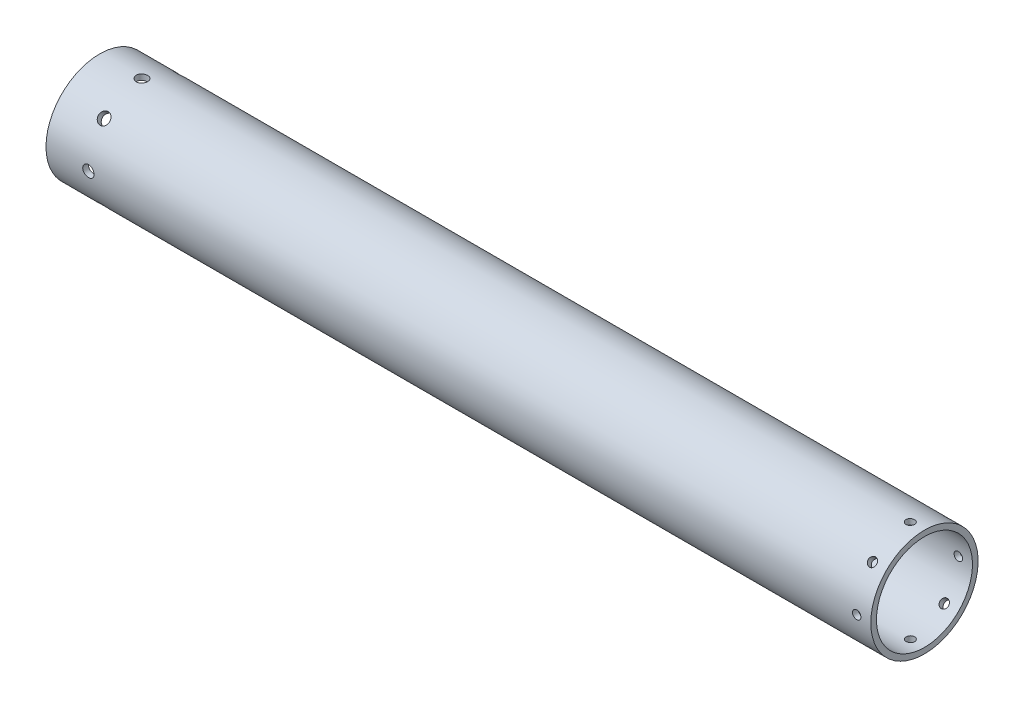
from build123d import *

# Parameters (mm, degrees)
SKETCH1_W          = 292.1
SKETCH1_H          = 2
SKETCH2_R          = 2
SKETCH2_R_2        = 1.5
CUT_EXTRUDE1_DEPTH = 294.333274621
CIRPATTERN1_COUNT  = 8


with BuildPart() as part:
    # Sketch1 → Revolve2 (revolve)
    with BuildSketch(Plane.XY, mode=Mode.PRIVATE) as revolve2_sk:
        with Locations((146.05, -18)):
            Rectangle(SKETCH1_W, SKETCH1_H)
    revolve(revolve2_sk.sketch.rotate(Axis((-46.732822098, 0, 0), (1, 0, 0)), 270), axis=Axis((-46.732822098, 0, 0), (1, 0, 0)))

    # Sketch2 → Cut-Extrude1 (cut, through all)
    with BuildSketch(Plane.XY):
        with Locations((15, 0)):
            Circle(SKETCH2_R)
        with Locations((287.1, 0)):
            Circle(SKETCH2_R_2)
    cut_extrude1 = extrude(amount=-CUT_EXTRUDE1_DEPTH, mode=Mode.SUBTRACT)

    # CirPattern1: Cut-Extrude1 ×8 about axis
    cirpattern1_axis = Axis((-46.732822098, 0, 0), (-1, 0, 0))
    for i in range(1, CIRPATTERN1_COUNT):
        add(cut_extrude1.rotate(cirpattern1_axis, i * 360 / CIRPATTERN1_COUNT), mode=Mode.SUBTRACT)


solid = part.part
